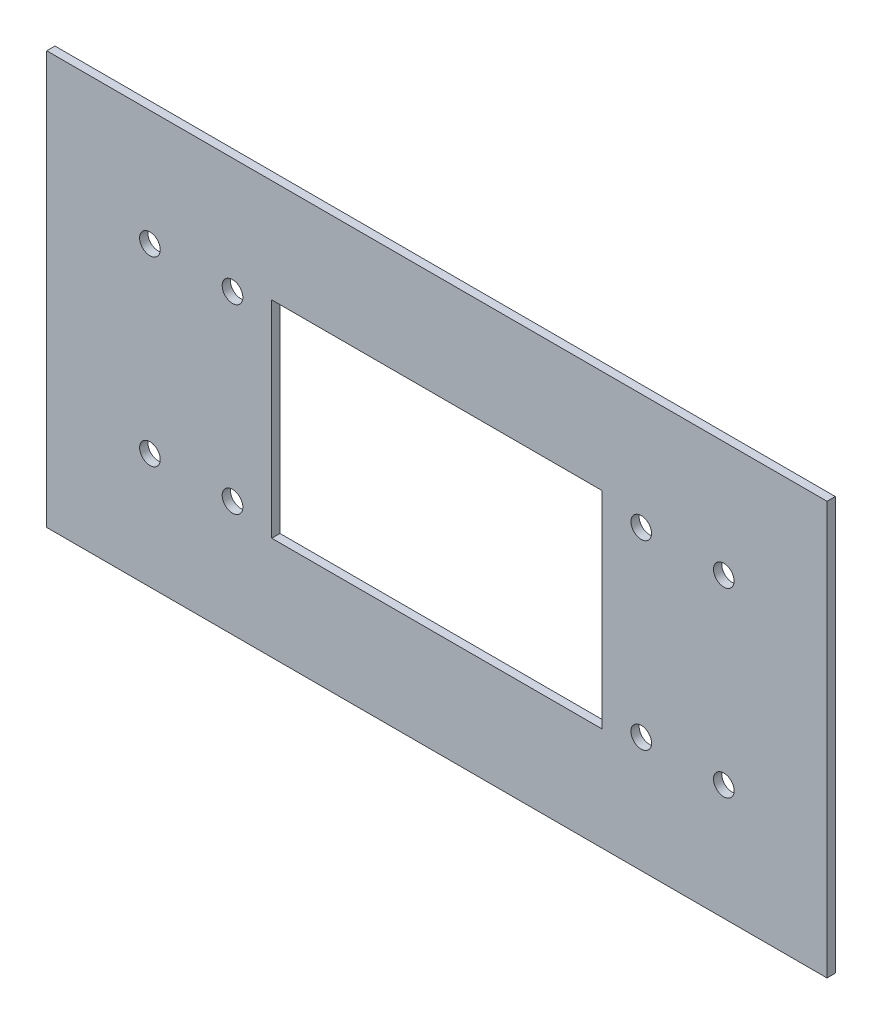
from build123d import *

# Parameters (mm, degrees)
SKETCH1_W           = 189
SKETCH1_H           = 100
SKETCH1_W_2         = 80
SKETCH1_H_2         = 50
BOSS_EXTRUDE1_DEPTH = 2
SKETCH2_R           = 2.5
CUT_EXTRUDE1_DEPTH  = 10


with BuildPart() as part:
    # Sketch1 → Boss-Extrude1 (new body)
    with BuildSketch(Plane.XY):
        with Locations((94.5, 50)):
            Rectangle(SKETCH1_W, SKETCH1_H)
        with Locations((94.5, 50)):
            Rectangle(SKETCH1_W_2, SKETCH1_H_2, mode=Mode.SUBTRACT)
    extrude(amount=BOSS_EXTRUDE1_DEPTH)

    # Sketch2 → Cut-Extrude1 (cut)
    with BuildSketch(Plane.XY.offset(2)):
        with Locations((25, 72)):
            Circle(SKETCH2_R)
        with Locations((45, 72)):
            Circle(SKETCH2_R)
        with Locations((25, 28)):
            Circle(SKETCH2_R)
        with Locations((45, 28)):
            Circle(SKETCH2_R)
        with Locations((144, 72)):
            Circle(SKETCH2_R)
        with Locations((164, 72)):
            Circle(SKETCH2_R)
        with Locations((144, 28)):
            Circle(SKETCH2_R)
        with Locations((164, 28)):
            Circle(SKETCH2_R)
    extrude(amount=-CUT_EXTRUDE1_DEPTH, mode=Mode.SUBTRACT)


solid = part.part
